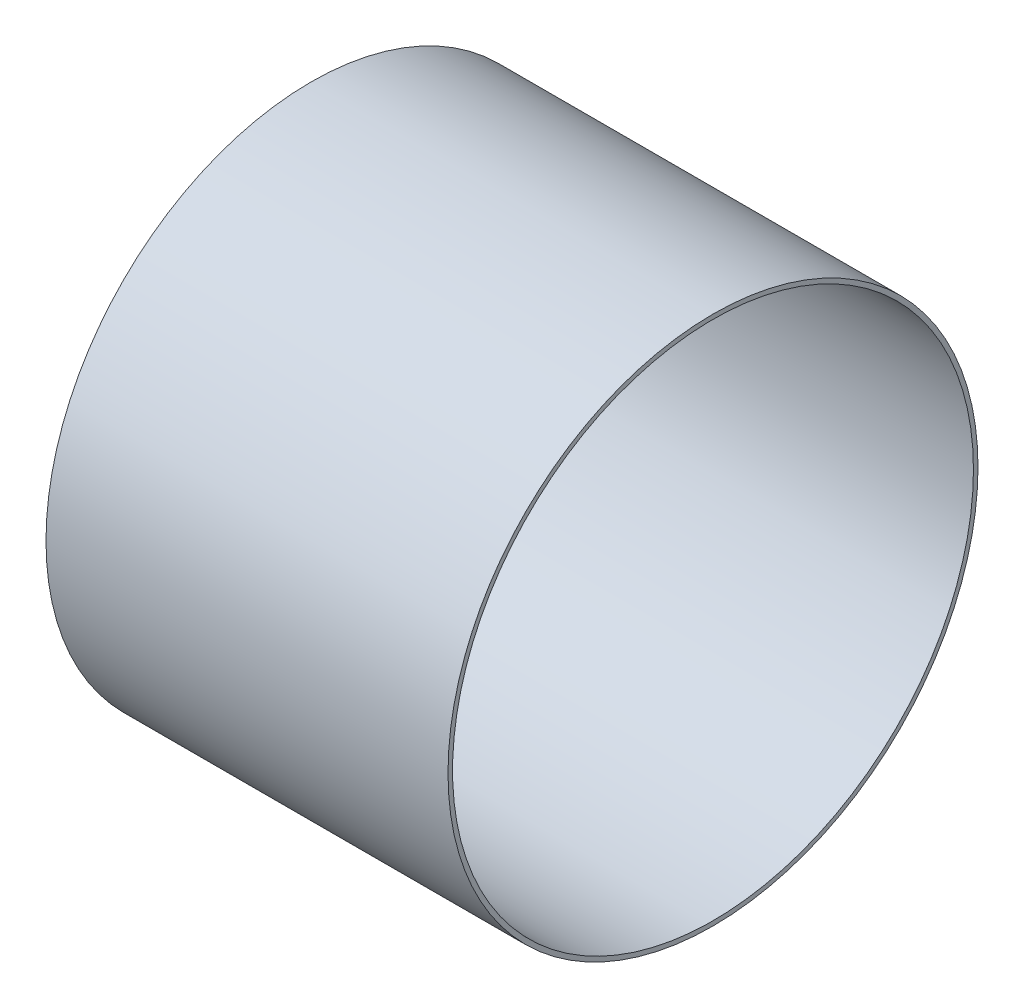
from build123d import *

# Parameters (mm, degrees)
SKETCH1_R           = 48.8442
SKETCH1_R_2         = 48.006
BOSS_EXTRUDE1_DEPTH = 74.09688


with BuildPart() as part:
    # Sketch1 → Boss-Extrude1 (new body)
    with BuildSketch(Plane(origin=(0, 0, 0), x_dir=(0, 0, -1), z_dir=(1, 0, 0))):
        Circle(SKETCH1_R)
        Circle(SKETCH1_R_2, mode=Mode.SUBTRACT)
    extrude(amount=BOSS_EXTRUDE1_DEPTH)


solid = part.part
